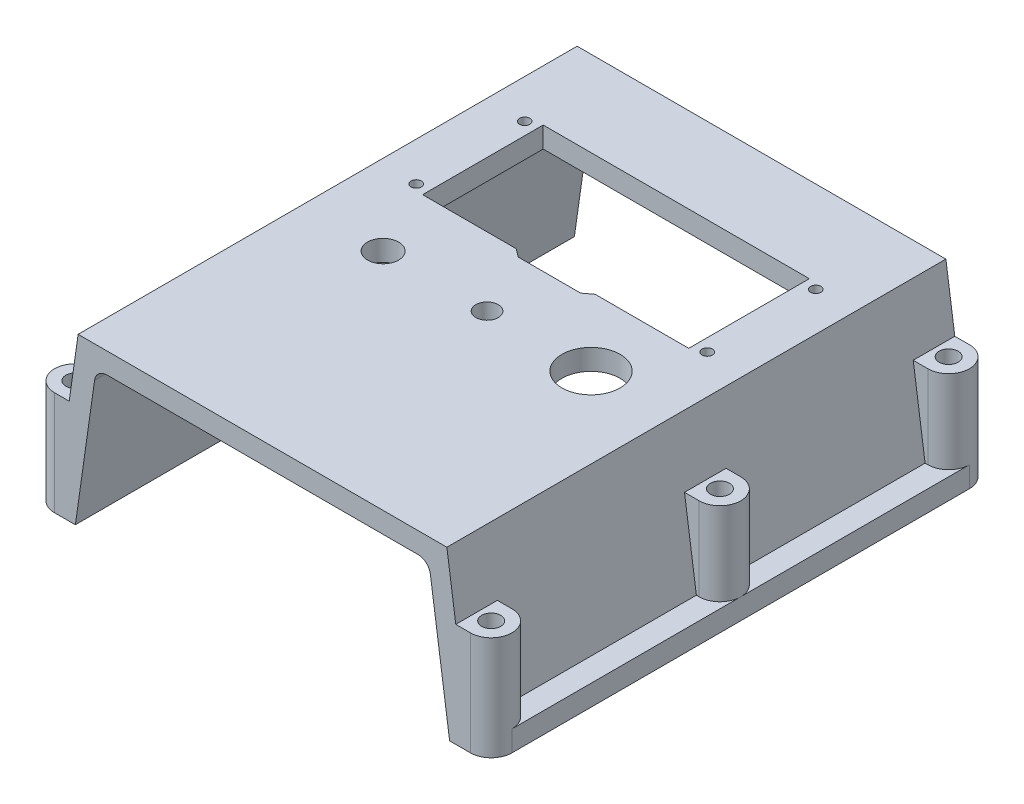
from build123d import *
from build123d.topology import SkipClean

# Parameters (mm, degrees)
BOSS_EXTRUDE1_DEPTH            = 120
FILLET1_R                      = 5
CUT_EXTRUDE1_REACH             = 139.931
SKETCH2_R                      = 1.25
SKETCH2_R_2                    = 2.7
SKETCH2_R_3                    = 3.75
SKETCH2_R_4                    = 7
SKETCH3_R                      = 2.3
BOSS_EXTRUDE2_DEPTH            = 20
CUT_EXTRUDE2_REACH             = 138.565
SKETCH3_4_R                    = 2.3
CUT_EXTRUDE2_DIRECTION_2_DEPTH = 13
FILLET2_R                      = 3


with BuildPart() as part:
    # Sketch1 → Boss-Extrude1 (new body)
    with BuildSketch(Plane.XY):
        Polygon((-45, -35), (-40, 0), (40, 0), (45, -35), (55, -35), (55, -30), (49.336477008, -30), (44.336477008, 5), (-44.336477008, 5), (-49.336477008, -30), (-55, -30), (-55, -35), align=None)
    extrude(amount=BOSS_EXTRUDE1_DEPTH)

    # Fillet1
    fillet1_edges = [part.edges().sort_by_distance(p)[0] for p in [
        (-55, -32.5, 120),
        (-55, -32.5, 0),
        (55, -32.5, 0),
        (55, -32.5, 120),
    ]]
    fillet(fillet1_edges, radius=FILLET1_R)

    # Sketch2 → Cut-Extrude1 (cut, up to next)
    with BuildSketch(Plane(origin=(0, 5, 0), x_dir=(1, 0, 0), z_dir=(0, 1, 0)), mode=Mode.PRIVATE) as cut_extrude1_sk1:
        Polygon((32, -20.5), (-32, -20.5), (-32, -49.5), (-9.5, -49.5), (-7.5, -51), (7.5, -51), (9.5, -49.5), (32, -49.5), align=None)
    cut_extrude1_tool1 = extrude(cut_extrude1_sk1.sketch, amount=-CUT_EXTRUDE1_REACH, mode=Mode.PRIVATE) & part.part
    # Sketch2 → Cut-Extrude1 (cut, up to next)
    with BuildSketch(Plane(origin=(0, 5, 0), x_dir=(1, 0, 0), z_dir=(0, 1, 0)), mode=Mode.PRIVATE) as cut_extrude1_sk2:
        with Locations((-35, -21.95)):
            Circle(SKETCH2_R)
    cut_extrude1_tool2 = extrude(cut_extrude1_sk2.sketch, amount=-CUT_EXTRUDE1_REACH, mode=Mode.PRIVATE) & part.part
    # Sketch2 → Cut-Extrude1 (cut, up to next)
    with BuildSketch(Plane(origin=(0, 5, 0), x_dir=(1, 0, 0), z_dir=(0, 1, 0)), mode=Mode.PRIVATE) as cut_extrude1_sk3:
        with Locations((-35, -48.05)):
            Circle(SKETCH2_R)
    cut_extrude1_tool3 = extrude(cut_extrude1_sk3.sketch, amount=-CUT_EXTRUDE1_REACH, mode=Mode.PRIVATE) & part.part
    # Sketch2 → Cut-Extrude1 (cut, up to next)
    with BuildSketch(Plane(origin=(0, 5, 0), x_dir=(1, 0, 0), z_dir=(0, 1, 0)), mode=Mode.PRIVATE) as cut_extrude1_sk4:
        with Locations((35, -48.05)):
            Circle(SKETCH2_R)
    cut_extrude1_tool4 = extrude(cut_extrude1_sk4.sketch, amount=-CUT_EXTRUDE1_REACH, mode=Mode.PRIVATE) & part.part
    # Sketch2 → Cut-Extrude1 (cut, up to next)
    with BuildSketch(Plane(origin=(0, 5, 0), x_dir=(1, 0, 0), z_dir=(0, 1, 0)), mode=Mode.PRIVATE) as cut_extrude1_sk5:
        with Locations((35, -21.95)):
            Circle(SKETCH2_R)
    cut_extrude1_tool5 = extrude(cut_extrude1_sk5.sketch, amount=-CUT_EXTRUDE1_REACH, mode=Mode.PRIVATE) & part.part
    # Sketch2 → Cut-Extrude1 (cut, up to next)
    with BuildSketch(Plane(origin=(0, 5, 0), x_dir=(1, 0, 0), z_dir=(0, 1, 0)), mode=Mode.PRIVATE) as cut_extrude1_sk6:
        with Locations((0, -66)):
            Circle(SKETCH2_R_2)
    cut_extrude1_tool6 = extrude(cut_extrude1_sk6.sketch, amount=-CUT_EXTRUDE1_REACH, mode=Mode.PRIVATE) & part.part
    # Sketch2 → Cut-Extrude1 (cut, up to next)
    with BuildSketch(Plane(origin=(0, 5, 0), x_dir=(1, 0, 0), z_dir=(0, 1, 0)), mode=Mode.PRIVATE) as cut_extrude1_sk7:
        with Locations((-25, -66)):
            Circle(SKETCH2_R_3)
    cut_extrude1_tool7 = extrude(cut_extrude1_sk7.sketch, amount=-CUT_EXTRUDE1_REACH, mode=Mode.PRIVATE) & part.part
    # Sketch2 → Cut-Extrude1 (cut, up to next)
    with BuildSketch(Plane(origin=(0, 5, 0), x_dir=(1, 0, 0), z_dir=(0, 1, 0)), mode=Mode.PRIVATE) as cut_extrude1_sk8:
        with Locations((25, -66)):
            Circle(SKETCH2_R_4)
    cut_extrude1_tool8 = extrude(cut_extrude1_sk8.sketch, amount=-CUT_EXTRUDE1_REACH, mode=Mode.PRIVATE) & part.part
    add(cut_extrude1_tool1.solids().sort_by_distance((0, 5, 35.206285))[0], mode=Mode.SUBTRACT)
    add(cut_extrude1_tool2.solids().sort_by_distance((-35, 5, 21.95))[0], mode=Mode.SUBTRACT)
    add(cut_extrude1_tool3.solids().sort_by_distance((-35, 5, 48.05))[0], mode=Mode.SUBTRACT)
    add(cut_extrude1_tool4.solids().sort_by_distance((35, 5, 48.05))[0], mode=Mode.SUBTRACT)
    add(cut_extrude1_tool5.solids().sort_by_distance((35, 5, 21.95))[0], mode=Mode.SUBTRACT)
    add(cut_extrude1_tool6.solids().sort_by_distance((0, 5, 66))[0], mode=Mode.SUBTRACT)
    add(cut_extrude1_tool7.solids().sort_by_distance((-25, 5, 66))[0], mode=Mode.SUBTRACT)
    add(cut_extrude1_tool8.solids().sort_by_distance((25, 5, 66))[0], mode=Mode.SUBTRACT)

    # Sketch3 → Boss-Extrude2 (add)
    # profile 1 of 6: a face of its own
    with SkipClean():  # the faces are left unmerged after this step: merging them gives an invalid solid
        with BuildSketch(Plane(origin=(0, -30, 0), x_dir=(1, 0, 0), z_dir=(0, 1, 0))):
            with BuildLine():
                Line((-50, 0), (-45, 0))
                Line((-45, 0), (-45, -10))
                Line((-45, -10), (-50, -10))
                ThreePointArc((-50, -10), (-55, -5), (-50, 0))
            make_face()
            with Locations((-50, -5)):
                Circle(SKETCH3_R, mode=Mode.SUBTRACT)
        # profile 2 of 6: a face of its own
        with BuildSketch(Plane(origin=(0, -30, 0), x_dir=(1, 0, 0), z_dir=(0, 1, 0))):
            with BuildLine():
                Line((-50, -55), (-45, -55))
                Line((-45, -55), (-45, -65))
                Line((-45, -65), (-50, -65))
                ThreePointArc((-50, -65), (-55, -60), (-50, -55))
            make_face()
            with Locations((-50, -60)):
                Circle(SKETCH3_R, mode=Mode.SUBTRACT)
        # profile 3 of 6: a face of its own
        with BuildSketch(Plane(origin=(0, -30, 0), x_dir=(1, 0, 0), z_dir=(0, 1, 0))):
            with BuildLine():
                Line((-50, -110), (-45, -110))
                Line((-45, -110), (-45, -120))
                Line((-45, -120), (-50, -120))
                ThreePointArc((-50, -120), (-55, -115), (-50, -110))
            make_face()
            with Locations((-50, -115)):
                Circle(SKETCH3_R, mode=Mode.SUBTRACT)
        # profile 4 of 6: a face of its own
        with BuildSketch(Plane(origin=(0, -30, 0), x_dir=(1, 0, 0), z_dir=(0, 1, 0))):
            with BuildLine():
                Line((50, -110), (45, -110))
                Line((45, -110), (45, -120))
                Line((45, -120), (50, -120))
                ThreePointArc((50, -120), (55, -115), (50, -110))
            make_face()
            with Locations((50, -115)):
                Circle(SKETCH3_R, mode=Mode.SUBTRACT)
        # profile 5 of 6: a face of its own
        with BuildSketch(Plane(origin=(0, -30, 0), x_dir=(1, 0, 0), z_dir=(0, 1, 0))):
            with BuildLine():
                Line((50, -65), (45, -65))
                Line((45, -65), (45, -55))
                Line((45, -55), (50, -55))
                ThreePointArc((50, -55), (55, -60), (50, -65))
            make_face()
            with Locations((50, -60)):
                Circle(SKETCH3_R, mode=Mode.SUBTRACT)
        # profile 6 of 6: a face of its own
        with BuildSketch(Plane(origin=(0, -30, 0), x_dir=(1, 0, 0), z_dir=(0, 1, 0))):
            with BuildLine():
                Line((50, 0), (45, 0))
                Line((45, 0), (45, -10))
                Line((45, -10), (50, -10))
                ThreePointArc((50, -10), (55, -5), (50, 0))
            make_face()
            with Locations((50, -5)):
                Circle(SKETCH3_R, mode=Mode.SUBTRACT)
        extrude(amount=BOSS_EXTRUDE2_DEPTH)

    # Sketch3<4> → Cut-Extrude2 (cut, up to next)
    with BuildSketch(Plane(origin=(0, -30, 0), x_dir=(1, 0, 0), z_dir=(0, 1, 0)), mode=Mode.PRIVATE) as cut_extrude2_sk1:
        with Locations((-50, -5)):
            Circle(SKETCH3_4_R)
    cut_extrude2_tool1 = extrude(cut_extrude2_sk1.sketch, amount=-CUT_EXTRUDE2_REACH, mode=Mode.PRIVATE) & part.part
    # Sketch3<4> → Cut-Extrude2 (cut, up to next)
    with BuildSketch(Plane(origin=(0, -30, 0), x_dir=(1, 0, 0), z_dir=(0, 1, 0)), mode=Mode.PRIVATE) as cut_extrude2_sk2:
        with Locations((-50, -60)):
            Circle(SKETCH3_4_R)
    cut_extrude2_tool2 = extrude(cut_extrude2_sk2.sketch, amount=-CUT_EXTRUDE2_REACH, mode=Mode.PRIVATE) & part.part
    # Sketch3<4> → Cut-Extrude2 (cut, up to next)
    with BuildSketch(Plane(origin=(0, -30, 0), x_dir=(1, 0, 0), z_dir=(0, 1, 0)), mode=Mode.PRIVATE) as cut_extrude2_sk3:
        with Locations((-50, -115)):
            Circle(SKETCH3_4_R)
    cut_extrude2_tool3 = extrude(cut_extrude2_sk3.sketch, amount=-CUT_EXTRUDE2_REACH, mode=Mode.PRIVATE) & part.part
    # Sketch3<4> → Cut-Extrude2 (cut, up to next)
    with BuildSketch(Plane(origin=(0, -30, 0), x_dir=(1, 0, 0), z_dir=(0, 1, 0)), mode=Mode.PRIVATE) as cut_extrude2_sk4:
        with Locations((50, -5)):
            Circle(SKETCH3_4_R)
    cut_extrude2_tool4 = extrude(cut_extrude2_sk4.sketch, amount=-CUT_EXTRUDE2_REACH, mode=Mode.PRIVATE) & part.part
    # Sketch3<4> → Cut-Extrude2 (cut, up to next)
    with BuildSketch(Plane(origin=(0, -30, 0), x_dir=(1, 0, 0), z_dir=(0, 1, 0)), mode=Mode.PRIVATE) as cut_extrude2_sk5:
        with Locations((50, -115)):
            Circle(SKETCH3_4_R)
    cut_extrude2_tool5 = extrude(cut_extrude2_sk5.sketch, amount=-CUT_EXTRUDE2_REACH, mode=Mode.PRIVATE) & part.part
    # Sketch3<4> → Cut-Extrude2 (cut, up to next)
    with BuildSketch(Plane(origin=(0, -30, 0), x_dir=(1, 0, 0), z_dir=(0, 1, 0)), mode=Mode.PRIVATE) as cut_extrude2_sk6:
        with Locations((50, -60)):
            Circle(SKETCH3_4_R)
    cut_extrude2_tool6 = extrude(cut_extrude2_sk6.sketch, amount=-CUT_EXTRUDE2_REACH, mode=Mode.PRIVATE) & part.part
    add(cut_extrude2_tool1.solids().sort_by_distance((-50, -30, 5))[0], mode=Mode.SUBTRACT)
    add(cut_extrude2_tool2.solids().sort_by_distance((-50, -30, 60))[0], mode=Mode.SUBTRACT)
    add(cut_extrude2_tool3.solids().sort_by_distance((-50, -30, 115))[0], mode=Mode.SUBTRACT)
    add(cut_extrude2_tool4.solids().sort_by_distance((50, -30, 5))[0], mode=Mode.SUBTRACT)
    add(cut_extrude2_tool5.solids().sort_by_distance((50, -30, 115))[0], mode=Mode.SUBTRACT)
    add(cut_extrude2_tool6.solids().sort_by_distance((50, -30, 60))[0], mode=Mode.SUBTRACT)

    # Sketch3<4> → Cut-Extrude2 direction 2 (cut)
    with SkipClean():  # the faces are left unmerged after this step: merging them gives an invalid solid
        with BuildSketch(Plane(origin=(0, -30, 0), x_dir=(1, 0, 0), z_dir=(0, 1, 0))):
            with Locations((-50, -5)):
                Circle(SKETCH3_4_R)
            with Locations((-50, -60)):
                Circle(SKETCH3_4_R)
            with Locations((-50, -115)):
                Circle(SKETCH3_4_R)
            with Locations((50, -5)):
                Circle(SKETCH3_4_R)
            with Locations((50, -115)):
                Circle(SKETCH3_4_R)
            with Locations((50, -60)):
                Circle(SKETCH3_4_R)
        extrude(amount=CUT_EXTRUDE2_DIRECTION_2_DEPTH, mode=Mode.SUBTRACT)

    # Fillet2
    fillet2_edges = [part.edges().sort_by_distance(p)[0] for p in [
        (40, 0, 60),
        (-40, 0, 60),
    ]]
    fillet(fillet2_edges, radius=FILLET2_R)


solid = part.part
